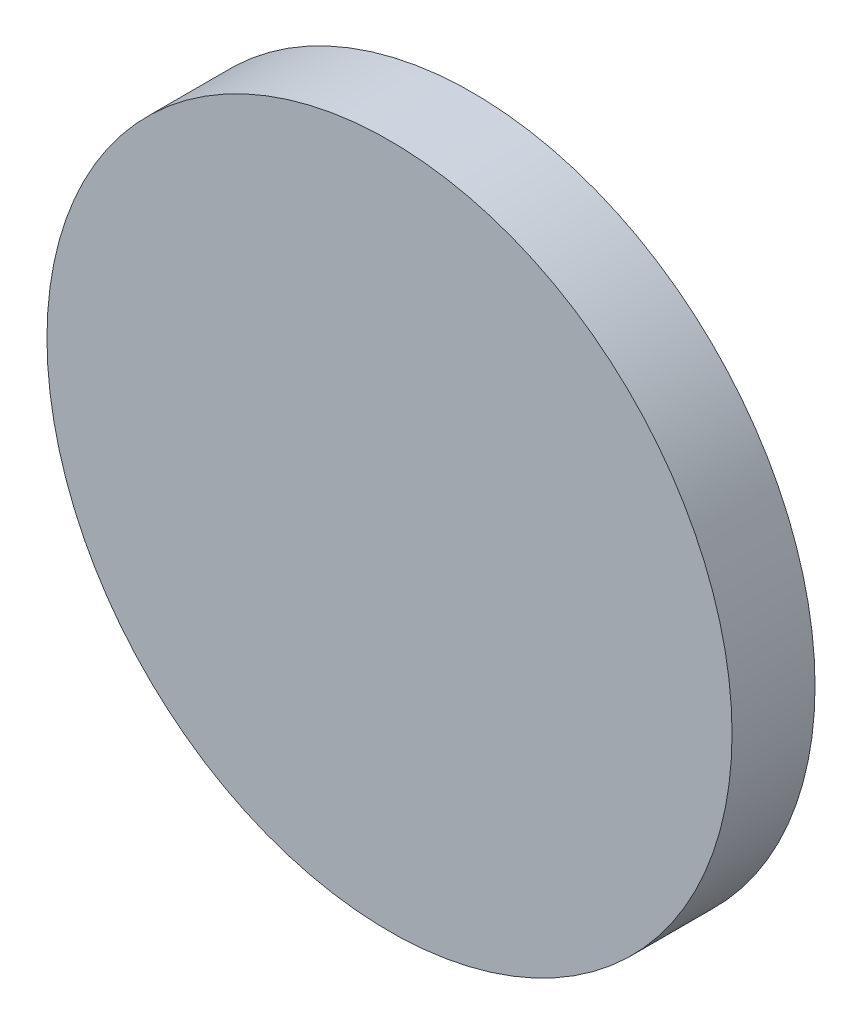
from build123d import *

# Parameters (mm, degrees)
SKETCH2_R           = 82.55
BOSS_EXTRUDE1_DEPTH = 20


with BuildPart() as part:
    # Sketch2 → Boss-Extrude1 (new body)
    with BuildSketch(Plane.XY):
        with Locations((0, -1.336429915)):
            Circle(SKETCH2_R)
    extrude(amount=BOSS_EXTRUDE1_DEPTH)


solid = part.part
